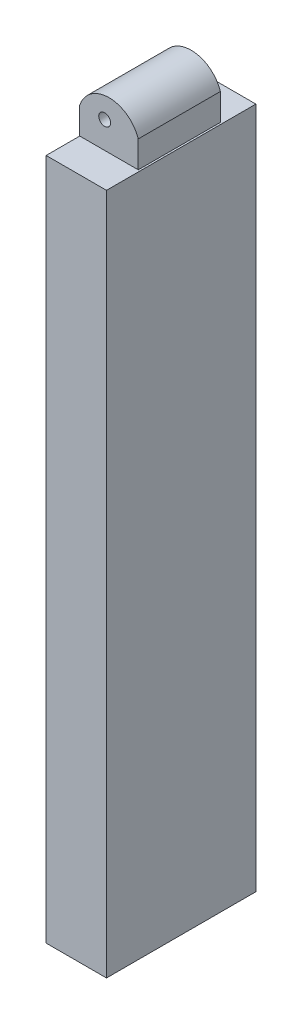
from build123d import *

# Parameters (mm, degrees)
SKETCH1_W           = 109.6
SKETCH1_H           = 24
BOSS_EXTRUDE1_DEPTH = 9.7
SKETCH3_W           = 9.4
SKETCH3_H           = 13.2
BOSS_EXTRUDE2_DEPTH = 8
SKETCH4_R           = 0.95
CUT_EXTRUDE1_DEPTH  = 67.210950756


with BuildPart() as part:
    # Sketch1 → Boss-Extrude1 (new body)
    with BuildSketch(Plane.YZ):
        Rectangle(SKETCH1_W, SKETCH1_H)
    extrude(amount=BOSS_EXTRUDE1_DEPTH)

    # Sketch3 → Boss-Extrude2 (add)
    with BuildSketch(Plane(origin=(0, 54.8, 0), x_dir=(-1, 0, 0), z_dir=(0, 1, 0))):
        with Locations((-4.7, 0)):
            Rectangle(SKETCH3_W, SKETCH3_H)
    extrude(amount=BOSS_EXTRUDE2_DEPTH)

    # Sketch4 → Cut-Extrude1 (cut, through all)
    with BuildSketch(Plane.XY.offset(6.6)):
        with BuildLine():
            Line((0, 62.8), (0, 59.1))
            ThreePointArc((0, 59.1), (4.7, 62.5), (9.4, 59.1))
            Line((9.4, 59.1), (9.4, 62.8))
            Line((9.4, 62.8), (0, 62.8))
        make_face()
        with Locations((4, 59.1)):
            Circle(SKETCH4_R)
    extrude(amount=-CUT_EXTRUDE1_DEPTH, mode=Mode.SUBTRACT)


solid = part.part
